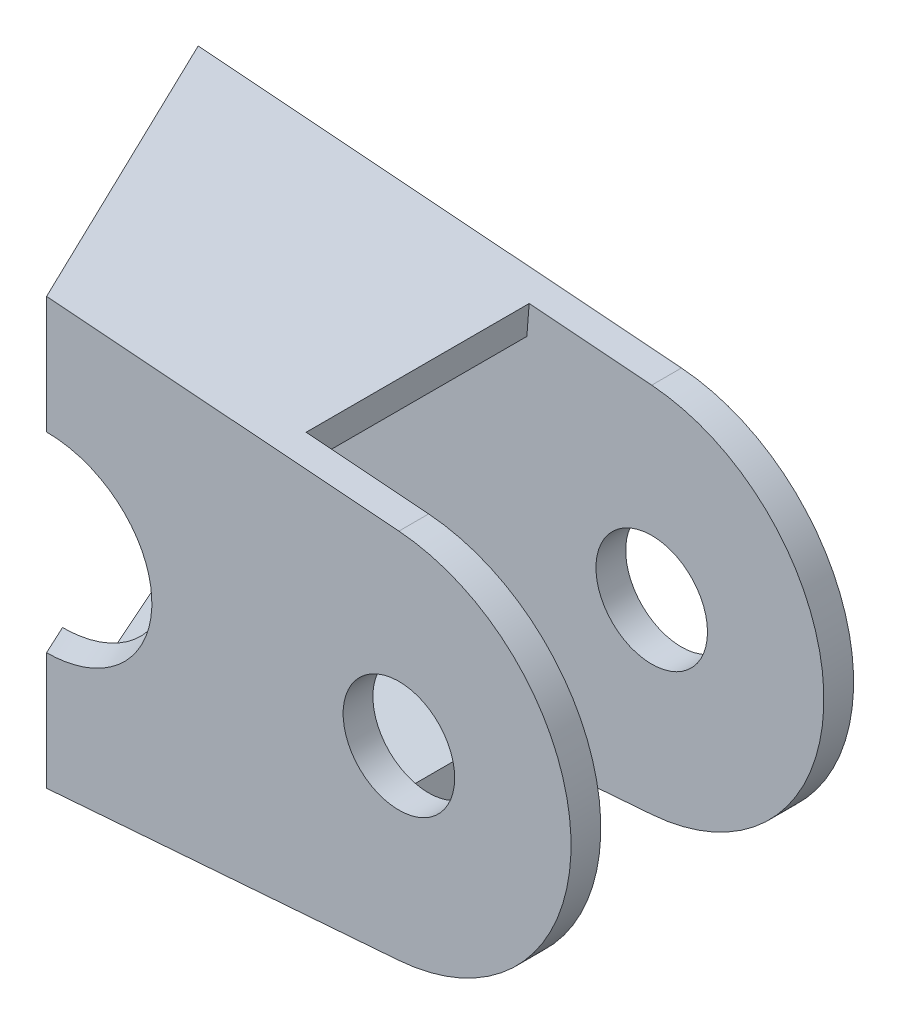
from build123d import *

# Parameters (mm, degrees)
SKETCH2_R           = 7.5
BOSS_EXTRUDE2_DEPTH = 4
CUT_EXTRUDE1_DEPTH  = 67
BOSS_EXTRUDE3_DEPTH = 4


with BuildPart() as part:
    # Sketch2 → Boss-Extrude2 (new body)
    with BuildSketch(Plane.XY.offset(15)):
        with BuildLine():
            Line((-65, 30), (-65, -30))
            Line((-65, -30), (0, -25))
            ThreePointArc((0, -25), (23.150778482, 0), (0, 25))
            Line((0, 25), (-65, 30))
        make_face()
        Circle(SKETCH2_R, mode=Mode.SUBTRACT)
    extrude(amount=BOSS_EXTRUDE2_DEPTH)


with BuildPart() as body_2:
    # Mirror2: mirrored copy
    add(part.part.mirror(Plane.XY))


with BuildPart() as cut_extrude1_tool:
    # 3DSketch3 → Cut-Extrude1 (new body)
    with BuildSketch(Plane(origin=(-40.440866858, 30.316826109, 33.980744524), x_dir=(-0.63193986599376, -0.7175244265183314, 0.2929346396678423), z_dir=(0.4205608285392174, 0, 0.9072643437821234))):
        with BuildLine():
            Line((0, 0), (12.532874387, 12.166226775))
            ThreePointArc((12.532874387, 12.166226775), (12.802609816, 30.336869108), (30.973252149, 30.067133679))
            Line((30.973252149, 30.067133679), (43.506126536, 42.233360454))
            Line((43.506126536, 42.233360454), (85.796169664, 0))
            Line((85.796169664, 0), (25.881179802, -39.378555401))
            Line((25.881179802, -39.378555401), (0, 0))
        make_face()
    extrude(amount=-CUT_EXTRUDE1_DEPTH)


with BuildPart() as part_1:
    add(part.part)

    # Cut-Extrude1: cut by cut_extrude1_tool
    add(cut_extrude1_tool.part, mode=Mode.SUBTRACT)



with BuildPart() as body_2_1:
    add(body_2.part)

    # Cut-Extrude1: cut by cut_extrude1_tool
    add(cut_extrude1_tool.part, mode=Mode.SUBTRACT)


with BuildPart() as part_2:
    add(part_1.part)

    add(body_2_1.part)  # Boss-Extrude3 merges body 2
    # Sketch3 → Boss-Extrude3 (add)
    with BuildSketch(Plane(origin=(1.911764706, 24.852941176, 0), x_dir=(0.9970544855015816, -0.0766964988847369, 0), z_dir=(0.0766964988847369, 0.9970544855015816, 0))):
        Polygon((-65.249765706, 15), (-51.302234569, -15), (-18.449990724, -15), (-18.449990724, 15), align=None)
    boss_extrude3 = extrude(amount=-BOSS_EXTRUDE3_DEPTH)

    # Mirror3: Boss-Extrude3 across plane
    add(boss_extrude3.mirror(Plane.ZX))


solid = part_2.part
